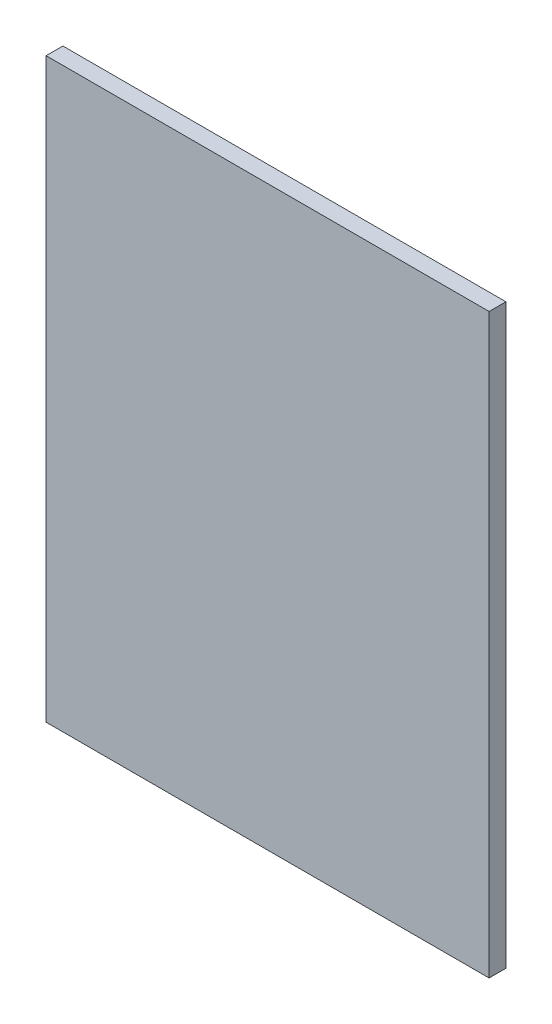
from build123d import *

# Parameters (mm, degrees)
SKETCH1_W           = 80.645
SKETCH1_H           = 112.395
BOSS_EXTRUDE1_DEPTH = 3.175
SKETCH2_W           = 3.175
SKETCH2_H           = 112.395
BOSS_EXTRUDE2_DEPTH = 3.175
SKETCH3_W           = 83.82
SKETCH3_H           = 3.175
CUT_EXTRUDE1_DEPTH  = 3.175


with BuildPart() as part:
    # Sketch1 → Boss-Extrude1 (new body)
    with BuildSketch(Plane.XY):
        Rectangle(SKETCH1_W, SKETCH1_H)
    extrude(amount=BOSS_EXTRUDE1_DEPTH)

    # Sketch2 → Boss-Extrude2 (add)
    with BuildSketch(Plane(origin=(40.3225, 0, 0), x_dir=(0, 0, -1), z_dir=(1, 0, 0))):
        with Locations((-1.5875, 0)):
            Rectangle(SKETCH2_W, SKETCH2_H)
    extrude(amount=BOSS_EXTRUDE2_DEPTH)

    # Sketch3 → Cut-Extrude1 (cut)
    with BuildSketch(Plane(origin=(0, 56.1975, 0), x_dir=(-1, 0, 0), z_dir=(0, 1, 0))):
        with Locations((-1.5875, 1.5875)):
            Rectangle(SKETCH3_W, SKETCH3_H)
    extrude(amount=-CUT_EXTRUDE1_DEPTH, mode=Mode.SUBTRACT)


solid = part.part
